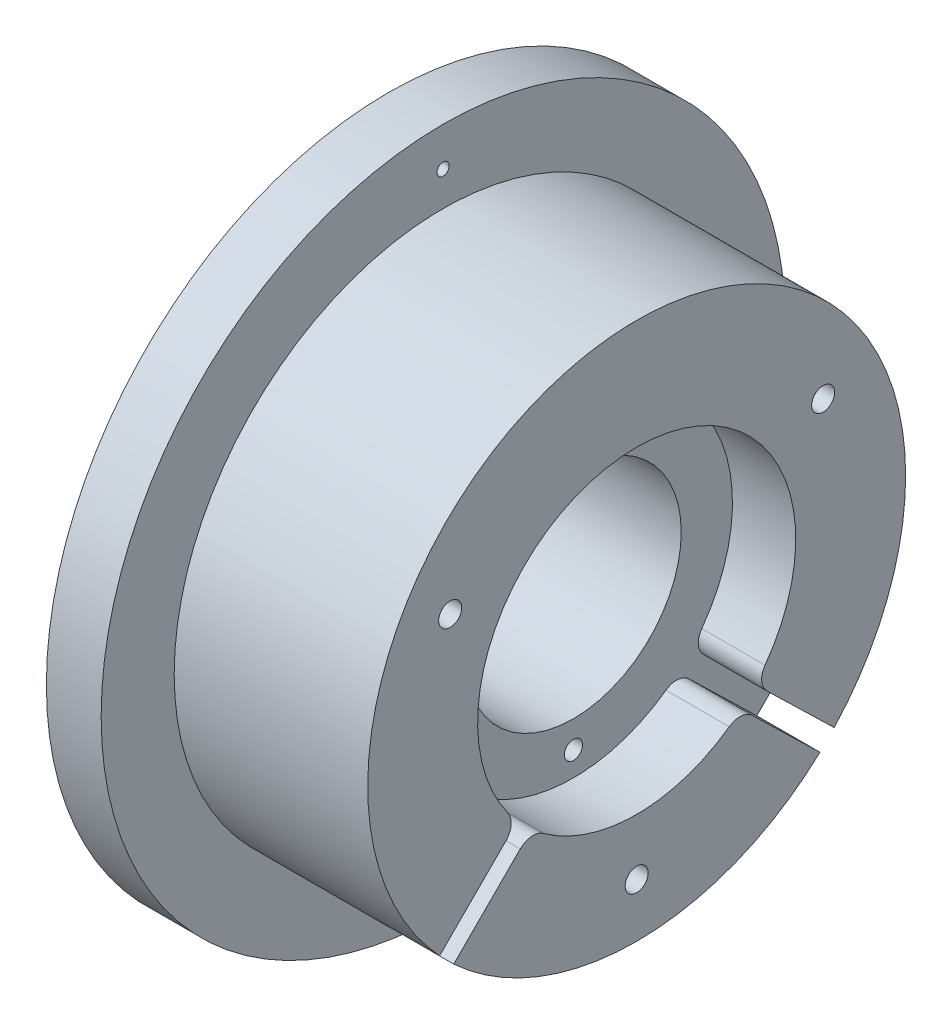
from build123d import *

# Parameters (mm, degrees)
SKETCH2_R                 = 0.315
CUT_EXTRUDE1_DEPTH        = 4.4
SKETCH3_R                 = 0.425
CUT_EXTRUDE2_DEPTH        = 37.233654202
SKETCH4_R                 = 0.635
CUT_EXTRUDE3_DEPTH        = 37.018615143
FILLET1_R                 = 1.25
M2X0_4_TAPPED_HOLE1_D     = 1.6
M2X0_4_TAPPED_HOLE1_DEPTH = 7.5
M2X0_4_TAPPED_HOLE1_TIP   = 0.480688495


with BuildPart() as part:
    # Sketch1 → Revolve1 (revolve)
    with BuildSketch(Plane.XY, mode=Mode.PRIVATE) as revolve1_sk:
        Polygon((0, 23.7871), (0, 7.5), (12.872, 7.5), (12.872, 11.0635), (17.272, 11.0635), (17.272, 18.7071), (3.81, 18.7071), (3.81, 23.7871), align=None)
    revolve(revolve1_sk.sketch.rotate(Axis((12.872, 0, 0), (-1, 0, 0)), 90), axis=Axis((12.872, 0, 0), (-1, 0, 0)))

    # Sketch2 → Cut-Extrude1 (cut)
    with BuildSketch(Plane(origin=(17.272, 0, 0), x_dir=(0, 0, -1), z_dir=(1, 0, 0))):
        with BuildLine():
            Line((-0.657808531, -0.677910665), (0, 0))
            Line((0, 0), (-0.494974747, 0.494974747))
            Line((-0.494974747, 0.494974747), (-8.302376115, -7.312426621))
            ThreePointArc((-8.302376115, -7.312426621), (-7.823075874, -7.823075874), (-7.312426621, -8.302376115))
            Line((-7.312426621, -8.302376115), (-0.16558691, -1.155536403))
            Line((-0.16558691, -1.155536403), (-0.657808531, -0.677910665))
        make_face()
        with BuildLine():
            Line((-12.723678558, -13.713628052), (-7.312426621, -8.302376115))
            ThreePointArc((-7.312426621, -8.302376115), (-7.823075874, -7.823075874), (-8.302376115, -7.312426621))
            Line((-8.302376115, -7.312426621), (-13.713628052, -12.723678558))
            ThreePointArc((-13.713628052, -12.723678558), (-13.473131789, -12.978070358), (-13.227917265, -13.227917267))
            ThreePointArc((-13.227917265, -13.227917267), (-12.978070357, -13.473131789), (-12.723678558, -13.713628052))
        make_face()
        with BuildLine():
            Line((13.738626304, -12.696682153), (8.250314399, -7.371115558))
            ThreePointArc((8.250314399, -7.371115558), (7.767282545, -7.878474098), (7.253109959, -8.354246116))
            Line((7.253109959, -8.354246116), (12.750537979, -13.688658505))
            ThreePointArc((12.750537979, -13.688658505), (13.09218126, -13.362274517), (13.425472665, -13.027366354))
            ThreePointArc((13.425472665, -13.027366354), (13.58305585, -12.862977268), (13.738626304, -12.696682153))
        make_face()
        with BuildLine():
            Line((8.250314399, -7.371115558), (0.317132147, 0.326823466))
            Line((0.317132147, 0.326823466), (0, 0))
            Line((0, 0), (0.494974747, -0.494974747))
            Line((0.494974747, -0.494974747), (-0.16558691, -1.155536403))
            Line((-0.16558691, -1.155536403), (7.253109959, -8.354246116))
            ThreePointArc((7.253109959, -8.354246116), (7.767282545, -7.878474098), (8.250314399, -7.371115558))
        make_face()
        with Locations((0, -14.9775)):
            Circle(SKETCH2_R)
        with Locations((-12.970895485, 7.48875)):
            Circle(SKETCH2_R)
        with Locations((12.970895485, 7.48875)):
            Circle(SKETCH2_R)
    extrude(amount=-CUT_EXTRUDE1_DEPTH, mode=Mode.SUBTRACT)

    # Sketch3 → Cut-Extrude2 (cut, through all)
    with BuildSketch(Plane(origin=(3.81, 0, 0), x_dir=(0, 0, -1), z_dir=(1, 0, 0))):
        with Locations(Location((0, 21.082, 0), (0, 0, 90))):
            Circle(SKETCH3_R)
    extrude(amount=-CUT_EXTRUDE2_DEPTH, mode=Mode.SUBTRACT)

    # Sketch4 → Cut-Extrude3 (cut, through all)
    with BuildSketch(Plane(origin=(12.872, 0, 0), x_dir=(0, 0, -1), z_dir=(1, 0, 0))):
        with Locations(Location((0, 9.375, 0), (0, 0, 90))):
            Circle(SKETCH4_R)
        with Locations(Location((0, -9.375, 0), (0, 0, 90))):
            Circle(SKETCH4_R)
    extrude(amount=-CUT_EXTRUDE3_DEPTH, mode=Mode.SUBTRACT)

    # Fillet1
    fillet1_edges = [part.edges().sort_by_distance(p)[0] for p in [
        (15.072, -7.312426621, 8.302376115),
        (15.072, -8.302376115, 7.312426621),
        (15.072, -7.371115558, -8.250314399),
        (15.072, -8.354246116, -7.253109959),
    ]]
    fillet(fillet1_edges, radius=FILLET1_R)

    # M2x0.4 Tapped Hole1
    with Locations(Plane(origin=(17.272, 7.48875, 12.970895485), x_dir=(0, 0, 1), z_dir=(1, 0, 0))):
        with Locations((0, 0), (-25.94179097, 0), (-12.970895485, 22.46625)):
            Hole(M2X0_4_TAPPED_HOLE1_D / 2, depth=M2X0_4_TAPPED_HOLE1_DEPTH)
            with Locations((0, 0, -(M2X0_4_TAPPED_HOLE1_DEPTH + M2X0_4_TAPPED_HOLE1_TIP / 2))):  # 118° drill point
                Cone(0, M2X0_4_TAPPED_HOLE1_D / 2, M2X0_4_TAPPED_HOLE1_TIP, mode=Mode.SUBTRACT)


solid = part.part
